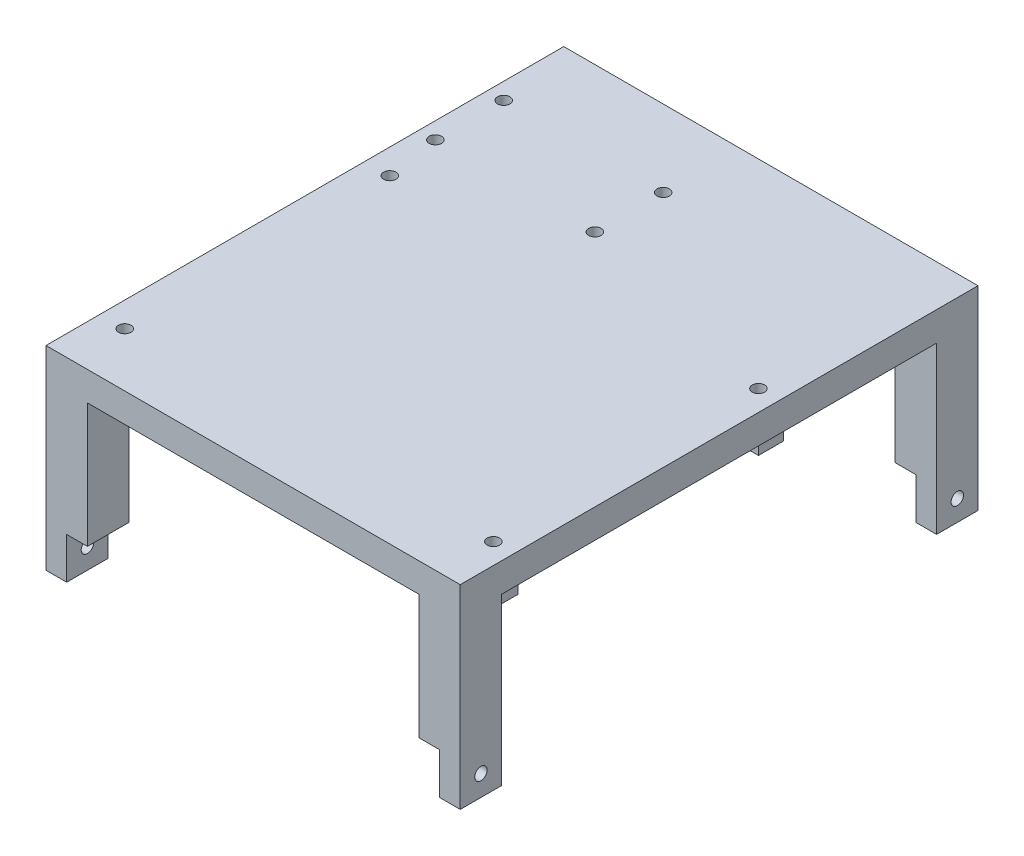
from build123d import *

# Parameters (mm, degrees)
SKETCH2_W           = 100
SKETCH2_H           = 80
BOSS_EXTRUDE1_DEPTH = 10
SKETCH3_W           = 10
SKETCH3_H           = 10
BOSS_EXTRUDE2_DEPTH = 30
SKETCH4_W           = 5
SKETCH4_H           = 10
BOSS_EXTRUDE3_DEPTH = 10
SKETCH5_W           = 6
SKETCH5_H           = 6
BOSS_EXTRUDE4_DEPTH = 4
SKETCH6_R           = 1.5
CUT_EXTRUDE1_DEPTH  = 134.026313187
SKETCH7_W           = 100
SKETCH7_H           = 10
BOSS_EXTRUDE5_DEPTH = 45
SKETCH8_W           = 10
SKETCH8_H           = 10
BOSS_EXTRUDE6_DEPTH = 30
SKETCH9_W           = 5
SKETCH9_H           = 10
BOSS_EXTRUDE7_DEPTH = 10
SKETCH10_R          = 1.5
CUT_EXTRUDE2_DEPTH  = 166
SKETCH11_R          = 1.5
CUT_EXTRUDE3_DEPTH  = 10
CUT_EXTRUDE4_REACH  = 167
SKETCH12_W          = 125
SKETCH12_H          = 3


with BuildPart() as part:
    # Sketch2 → Boss-Extrude1 (new body)
    with BuildSketch(Plane(origin=(0, 0, 0), x_dir=(1, 0, 0), z_dir=(0, 1, 0))):
        with Locations((50, 40)):
            Rectangle(SKETCH2_W, SKETCH2_H)
    extrude(amount=BOSS_EXTRUDE1_DEPTH)

    # Sketch3 → Boss-Extrude2 (add)
    with BuildSketch(Plane.XZ):
        with Locations((95, -5)):
            Rectangle(SKETCH3_W, SKETCH3_H)
        with Locations((5, -5)):
            Rectangle(SKETCH3_W, SKETCH3_H)
    extrude(amount=BOSS_EXTRUDE2_DEPTH)

    # Sketch4 → Boss-Extrude3 (add)
    with BuildSketch(Plane.XZ.offset(30)):
        with Locations((2.5, -5)):
            Rectangle(SKETCH4_W, SKETCH4_H)
        with Locations((97.5, -5)):
            Rectangle(SKETCH4_W, SKETCH4_H)
    extrude(amount=BOSS_EXTRUDE3_DEPTH)

    # Sketch5 → Boss-Extrude4 (add)
    with BuildSketch(Plane.XZ):
        with Locations((6, -13)):
            Rectangle(SKETCH5_W, SKETCH5_H)
        with Locations((95, -13)):
            Rectangle(SKETCH5_W, SKETCH5_H)
        with Locations((95, -77)):
            Rectangle(SKETCH5_W, SKETCH5_H)
        with Locations((6, -77)):
            Rectangle(SKETCH5_W, SKETCH5_H)
    extrude(amount=BOSS_EXTRUDE4_DEPTH)

    # Sketch6 → Cut-Extrude1 (cut, through all)
    with BuildSketch(Plane.XZ.offset(4)):
        with Locations(Location((6, -13, 0), (0, 0, 270))):
            Circle(SKETCH6_R)
        with Locations(Location((95, -13, 0), (0, 0, 270))):
            Circle(SKETCH6_R)
        with Locations(Location((95, -77, 0), (0, 0, 270))):
            Circle(SKETCH6_R)
        with Locations(Location((6, -77, 0), (0, 0, 270))):
            Circle(SKETCH6_R)
    extrude(amount=-CUT_EXTRUDE1_DEPTH, mode=Mode.SUBTRACT)

    # Sketch7 → Boss-Extrude5 (add)
    with BuildSketch(Plane(origin=(0, 0, -80), x_dir=(-1, 0, 0), z_dir=(0, 0, -1))):
        with Locations((-50, 5)):
            Rectangle(SKETCH7_W, SKETCH7_H)
    extrude(amount=BOSS_EXTRUDE5_DEPTH)

    # Sketch8 → Boss-Extrude6 (add)
    with BuildSketch(Plane.XZ):
        with Locations((5, -120)):
            Rectangle(SKETCH8_W, SKETCH8_H)
        with Locations((95, -120)):
            Rectangle(SKETCH8_W, SKETCH8_H)
    extrude(amount=BOSS_EXTRUDE6_DEPTH)

    # Sketch9 → Boss-Extrude7 (add)
    with BuildSketch(Plane.XZ.offset(30)):
        with Locations((2.5, -120)):
            Rectangle(SKETCH9_W, SKETCH9_H)
        with Locations((97.5, -120)):
            Rectangle(SKETCH9_W, SKETCH9_H)
    extrude(amount=BOSS_EXTRUDE7_DEPTH)

    # Sketch10 → Cut-Extrude2 (cut, through all)
    with BuildSketch(Plane.ZY):
        with Locations((-5, -35)):
            Circle(SKETCH10_R)
        with Locations((-120, -35)):
            Circle(SKETCH10_R)
    extrude(amount=-CUT_EXTRUDE2_DEPTH, mode=Mode.SUBTRACT)

    # Sketch11 → Cut-Extrude3 (cut)
    with BuildSketch(Plane.XZ):
        with Locations(Location((4, -106.5, 0), (0, 0, 270))):
            Circle(SKETCH11_R)
        with Locations(Location((4, -90, 0), (0, 0, 270))):
            Circle(SKETCH11_R)
        with Locations(Location((42.5, -106.5, 0), (0, 0, 270))):
            Circle(SKETCH11_R)
        with Locations(Location((42.5, -90, 0), (0, 0, 270))):
            Circle(SKETCH11_R)
    extrude(amount=-CUT_EXTRUDE3_DEPTH, mode=Mode.SUBTRACT)

    # Cut-Extrude4: up to this face of the body (flat: up to its plane)
    cut_extrude4_end = Plane(part.part.faces().sort_by_distance((0, 8.653708798, -62.5))[0])
    # Sketch12 → Cut-Extrude4 (cut, up to the picked face)
    with BuildSketch(Plane(origin=(100, 0, 0), x_dir=(0, 0, -1), z_dir=(1, 0, 0)), mode=Mode.PRIVATE) as cut_extrude4_sk1:
        with Locations((62.5, 8.5)):
            Rectangle(SKETCH12_W, SKETCH12_H)
    cut_extrude4_tool1 = split(extrude(cut_extrude4_sk1.sketch, amount=-CUT_EXTRUDE4_REACH, mode=Mode.PRIVATE), bisect_by=cut_extrude4_end, keep=Keep.BOTH, mode=Mode.PRIVATE)
    add(cut_extrude4_tool1.solids().sort_by(Axis((100, 8.5, -62.5), (-1, 0, 0)))[0], mode=Mode.SUBTRACT)


solid = part.part
